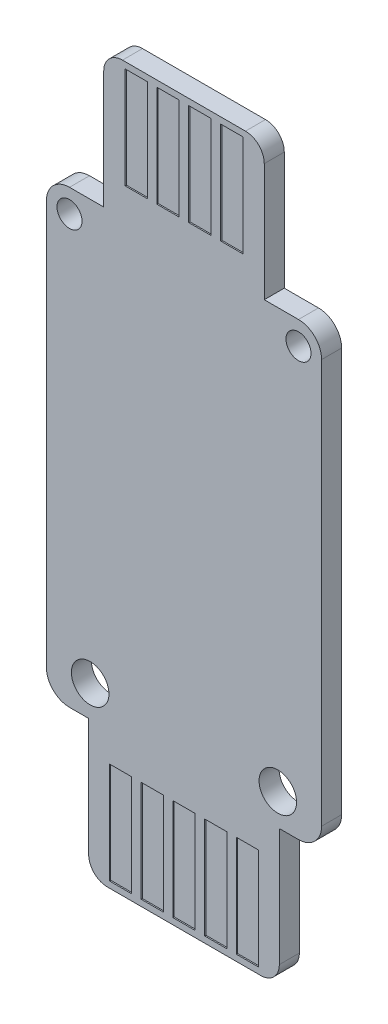
from build123d import *

# Parameters (mm, degrees)
SKETCH_1_R          = 1
EXTRUDE_1_DEPTH     = 1.6
SKETCH_3_R          = 1.5
CUT_EXTRUDE_1_DEPTH = 1.6
CUT_EXTRUDE_2_DEPTH = 1.6
EXTRUDE_2_DEPTH     = 1.6
SKETCH_8_W          = 1.78
SKETCH_8_H          = 8.1
CUT_EXTRUDE_3_DEPTH = 0.1
CUT_EXTRUDE_START   = 1.6
SKETCH_9_W          = 1.78
SKETCH_9_H          = 8.1
CUT_EXTRUDE_4_DEPTH = 0.1
EXTRUDE_START       = 1.6
EXTRUDE_3_DEPTH     = 1.6
SKETCH_12_W         = 1.78
SKETCH_12_H         = 8.1
CUT_EXTRUDE_5_DEPTH = 0.1
SKETCH_13_W         = 1.78
SKETCH_13_H         = 8.1
CUT_EXTRUDE_6_DEPTH = 0.1


with BuildPart() as part:
    # 草图1 → 凸台-拉伸1 (new body)
    with BuildSketch(Plane.XY):
        with BuildLine():
            Line((-9.15, 16), (9.15, 16))
            ThreePointArc((9.15, 16), (10.458147545, 15.458147545), (11, 14.15))
            Line((11, 14.15), (11, -20))
            Line((11, -20), (-11, -20))
            Line((-11, -20), (-11, 14.15))
            ThreePointArc((-11, 14.15), (-10.458147545, 15.458147545), (-9.15, 16))
        make_face()
        with Locations((-9.15, 14.15)):
            Circle(SKETCH_1_R, mode=Mode.SUBTRACT)
        with Locations((9.15, 14.15)):
            Circle(SKETCH_1_R, mode=Mode.SUBTRACT)
    extrude(amount=EXTRUDE_1_DEPTH)

    # 草图3 → 切除-拉伸1 (cut)
    with BuildSketch(Plane.XY):
        with Locations((-7.5, -17.5)):
            Circle(SKETCH_3_R)
        with Locations((7.5, -17.5)):
            Circle(SKETCH_3_R)
    extrude(amount=CUT_EXTRUDE_1_DEPTH, mode=Mode.SUBTRACT)

    # 草图5 → 切除-拉伸2 (cut)
    with BuildSketch(Plane.XY):
        with BuildLine():
            Line((11, -20), (11, -18.15))
            ThreePointArc((11, -18.15), (10.458147545, -19.458147545), (9.15, -20))
            Line((9.15, -20), (11, -20))
        make_face()
        with BuildLine():
            Line((-11, -20), (-9.15, -20))
            ThreePointArc((-9.15, -20), (-10.458147545, -19.458147545), (-11, -18.15))
            Line((-11, -18.15), (-11, -20))
        make_face()
    extrude(amount=CUT_EXTRUDE_2_DEPTH, mode=Mode.SUBTRACT)

    # 草图7 → 凸台-拉伸2 (add)
    with BuildSketch(Plane.XY):
        with BuildLine():
            Line((-4.915, 26.92), (4.915, 26.92))
            ThreePointArc((4.915, 26.92), (5.975660172, 26.480660172), (6.415, 25.42))
            Line((6.415, 25.42), (6.415, 16))
            Line((6.415, 16), (-6.415, 16))
            Line((-6.415, 16), (-6.415, 25.42))
            ThreePointArc((-6.415, 25.42), (-5.975660172, 26.480660172), (-4.915, 26.92))
        make_face()
        with BuildLine():
            Line((-6.415, -20), (6.415, -20))
            Line((6.415, -20), (6.415, -29.42))
            ThreePointArc((6.415, -29.42), (5.975660172, -30.480660172), (4.915, -30.92))
            Line((4.915, -30.92), (-4.915, -30.92))
            ThreePointArc((-4.915, -30.92), (-5.975660172, -30.480660172), (-6.415, -29.42))
            Line((-6.415, -29.42), (-6.415, -20))
        make_face()
    extrude(amount=EXTRUDE_2_DEPTH)

    # 草图8 → 切除-拉伸3 (cut)
    with BuildSketch(Plane.XY):
        with Locations((-1.27, 22.37)):
            Rectangle(SKETCH_8_W, SKETCH_8_H)
        with Locations((-3.81, 22.37)):
            Rectangle(SKETCH_8_W, SKETCH_8_H)
        with Locations((3.81, 22.37)):
            Rectangle(SKETCH_8_W, SKETCH_8_H)
        with Locations((1.27, 22.37)):
            Rectangle(SKETCH_8_W, SKETCH_8_H)
        with Locations((1.27, -26.37)):
            Rectangle(SKETCH_8_W, SKETCH_8_H)
        with Locations((3.81, -26.37)):
            Rectangle(SKETCH_8_W, SKETCH_8_H)
        with Locations((-3.81, -26.37)):
            Rectangle(SKETCH_8_W, SKETCH_8_H)
        with Locations((-1.27, -26.37)):
            Rectangle(SKETCH_8_W, SKETCH_8_H)
    extrude(amount=CUT_EXTRUDE_3_DEPTH, mode=Mode.SUBTRACT)

    # 草图9 → 切除-拉伸4 (cut)
    with BuildSketch(Plane.XY.offset(CUT_EXTRUDE_START)):
        with Locations((-1.27, 22.37)):
            Rectangle(SKETCH_9_W, SKETCH_9_H)
        with Locations((1.27, 22.37)):
            Rectangle(SKETCH_9_W, SKETCH_9_H)
        with Locations((3.81, 22.37)):
            Rectangle(SKETCH_9_W, SKETCH_9_H)
        with Locations((-3.81, 22.37)):
            Rectangle(SKETCH_9_W, SKETCH_9_H)
        with Locations((-1.27, -26.37)):
            Rectangle(SKETCH_9_W, SKETCH_9_H)
        with Locations((-3.81, -26.37)):
            Rectangle(SKETCH_9_W, SKETCH_9_H)
        with Locations((3.81, -26.37)):
            Rectangle(SKETCH_9_W, SKETCH_9_H)
        with Locations((1.27, -26.37)):
            Rectangle(SKETCH_9_W, SKETCH_9_H)
    extrude(amount=-CUT_EXTRUDE_4_DEPTH, mode=Mode.SUBTRACT)

    # 草图11 → 凸台-拉伸3 (add)
    with BuildSketch(Plane.XY.offset(EXTRUDE_START)):
        with BuildLine():
            Line((-7.62, -20), (7.62, -20))
            Line((7.62, -20), (7.62, -29.42))
            ThreePointArc((7.62, -29.42), (7.180660172, -30.480660172), (6.12, -30.92))
            Line((6.12, -30.92), (-6.12, -30.92))
            ThreePointArc((-6.12, -30.92), (-7.180660172, -30.480660172), (-7.62, -29.42))
            Line((-7.62, -29.42), (-7.62, -20))
        make_face()
    extrude(amount=-EXTRUDE_3_DEPTH)

    # 草图12 → 切除-拉伸5 (cut)
    with BuildSketch(Plane.XY):
        with Locations((0, -26.37)):
            Rectangle(SKETCH_12_W, SKETCH_12_H)
        with Locations((2.54, -26.37)):
            Rectangle(SKETCH_12_W, SKETCH_12_H)
        with Locations((5.08, -26.37)):
            Rectangle(SKETCH_12_W, SKETCH_12_H)
        with Locations((-2.54, -26.37)):
            Rectangle(SKETCH_12_W, SKETCH_12_H)
        with Locations((-5.08, -26.37)):
            Rectangle(SKETCH_12_W, SKETCH_12_H)
    extrude(amount=CUT_EXTRUDE_5_DEPTH, mode=Mode.SUBTRACT)

    # 草图13 → 切除-拉伸6 (cut)
    with BuildSketch(Plane.XY.offset(CUT_EXTRUDE_START)):
        with Locations((2.54, -26.37)):
            Rectangle(SKETCH_13_W, SKETCH_13_H)
        with Locations((0, -26.37)):
            Rectangle(SKETCH_13_W, SKETCH_13_H)
        with Locations((-5.08, -26.37)):
            Rectangle(SKETCH_13_W, SKETCH_13_H)
        with Locations((-2.54, -26.37)):
            Rectangle(SKETCH_13_W, SKETCH_13_H)
        with Locations((5.08, -26.37)):
            Rectangle(SKETCH_13_W, SKETCH_13_H)
    extrude(amount=-CUT_EXTRUDE_6_DEPTH, mode=Mode.SUBTRACT)


solid = part.part
